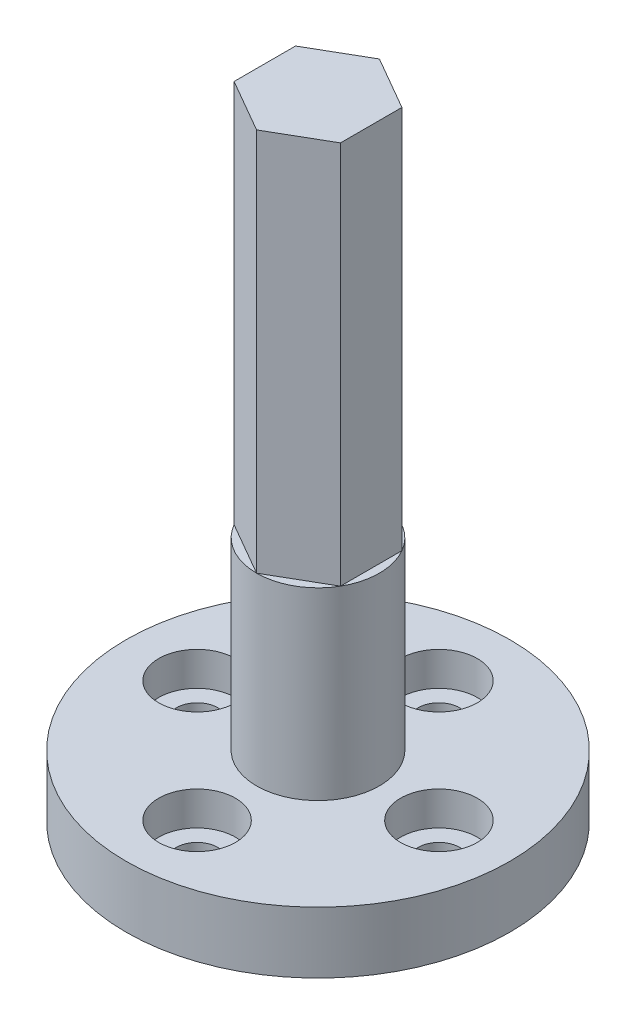
from build123d import *

# Parameters (mm, degrees)
CROQUIS3_R              = 12.5
SALIENTE_EXTRUIR1_DEPTH = 4
CROQUIS4_R              = 4
SALIENTE_EXTRUIR2_DEPTH = 37
CROQUIS12_OUTSIDE_W     = 37.828
CROQUIS12_OUTSIDE_H     = 37.828
CORTAR_EXTRUIR7_DEPTH   = 25
CROQUIS13_R             = 1.35
CORTAR_EXTRUIR8_DEPTH   = 10
CROQUIS14_R             = 2.5
CORTAR_EXTRUIR9_DEPTH   = 2.2


with BuildPart() as part:
    # Croquis3 → Saliente-Extruir1 (new body)
    with BuildSketch(Plane(origin=(0, 0, 0), x_dir=(1, 0, 0), z_dir=(0, 1, 0))):
        with Locations(Location((0, 0, 0), (0, 0, 270))):
            Circle(CROQUIS3_R)
    extrude(amount=SALIENTE_EXTRUIR1_DEPTH)

    # Croquis4 → Saliente-Extruir2 (add)
    with BuildSketch(Plane(origin=(0, 4, 0), x_dir=(1, 0, 0), z_dir=(0, 1, 0))):
        with Locations(Location((0, 0, 0), (0, 0, 270))):
            Circle(CROQUIS4_R)
    extrude(amount=SALIENTE_EXTRUIR2_DEPTH)

    # Croquis12 outside → Cortar-Extruir7 (cut)
    with BuildSketch(Plane(origin=(0, 41, 0), x_dir=(1, 0, 0), z_dir=(0, 1, 0))):
        Rectangle(CROQUIS12_OUTSIDE_W, CROQUIS12_OUTSIDE_H)
        Polygon((0, 4), (-3.464101615, 2), (-3.464101615, -2), (0, -4), (3.464101615, -2), (3.464101615, 2), align=None, mode=Mode.SUBTRACT)
    extrude(amount=-CORTAR_EXTRUIR7_DEPTH, mode=Mode.SUBTRACT)

    # Croquis13 → Cortar-Extruir8 (cut)
    with BuildSketch(Plane.XZ):
        with Locations(Location((0, 7.875, 0), (0, 0, 270))):
            Circle(CROQUIS13_R)
        with Locations(Location((7.875, 0, 0), (0, 0, 270))):
            Circle(CROQUIS13_R)
        with Locations(Location((0, -7.875, 0), (0, 0, 270))):
            Circle(CROQUIS13_R)
        with Locations(Location((-7.875, 0, 0), (0, 0, 270))):
            Circle(CROQUIS13_R)
    extrude(amount=-CORTAR_EXTRUIR8_DEPTH, mode=Mode.SUBTRACT)

    # Croquis14 → Cortar-Extruir9 (cut)
    with BuildSketch(Plane(origin=(0, 4, 0), x_dir=(1, 0, 0), z_dir=(0, 1, 0))):
        with Locations(Location((0, 7.875, 0), (0, 0, 270))):
            Circle(CROQUIS14_R)
        with Locations(Location((7.875, 0, 0), (0, 0, 270))):
            Circle(CROQUIS14_R)
        with Locations(Location((0, -7.875, 0), (0, 0, 270))):
            Circle(CROQUIS14_R)
        with Locations(Location((-7.875, 0, 0), (0, 0, 270))):
            Circle(CROQUIS14_R)
    extrude(amount=-CORTAR_EXTRUIR9_DEPTH, mode=Mode.SUBTRACT)


solid = part.part
